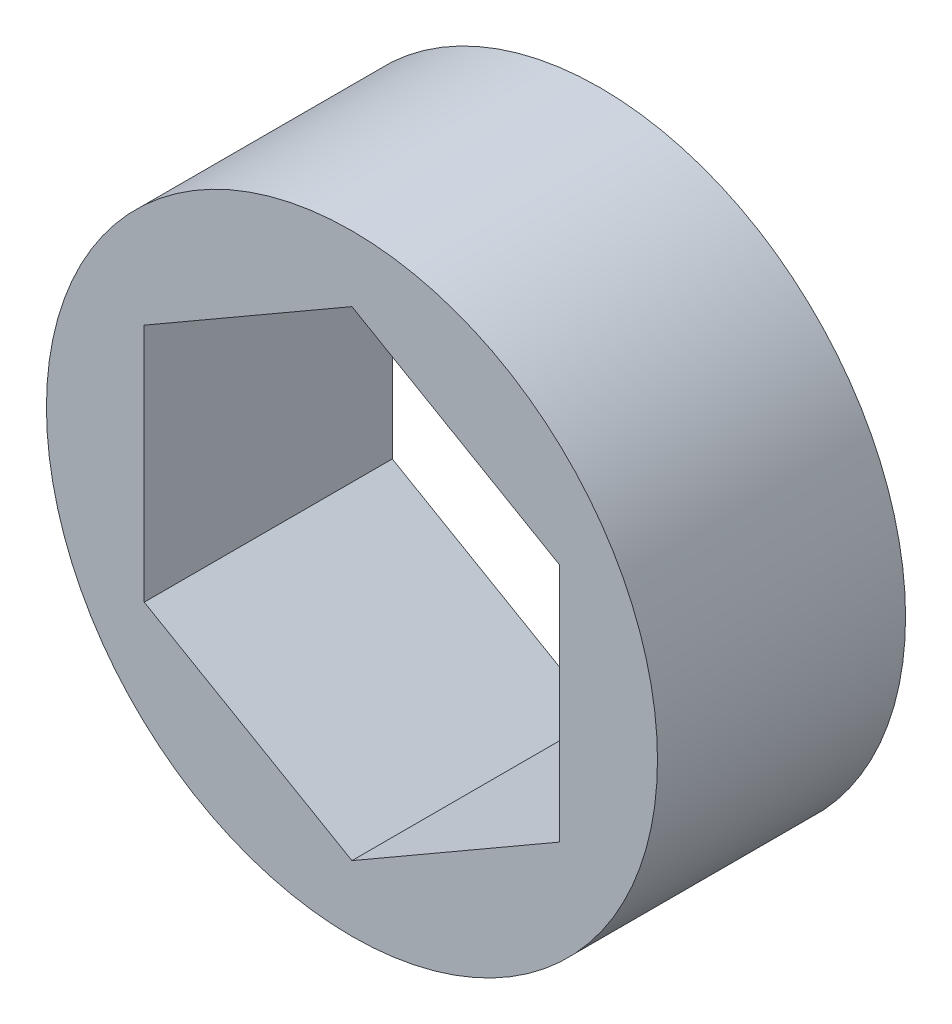
from build123d import *

# Parameters (mm, degrees)
SKETCH1_R           = 9.525
BOSS_EXTRUDE1_DEPTH = 7.7343


with BuildPart() as part:
    # Sketch1 → Boss-Extrude1 (new body)
    with BuildSketch(Plane.XY):
        Circle(SKETCH1_R)
        Polygon((0, 7.478995387), (-6.477, 3.739497694), (-6.477, -3.739497694), (0, -7.478995387), (6.477, -3.739497694), (6.477, 3.739497694), align=None, mode=Mode.SUBTRACT)
    extrude(amount=BOSS_EXTRUDE1_DEPTH)


solid = part.part
